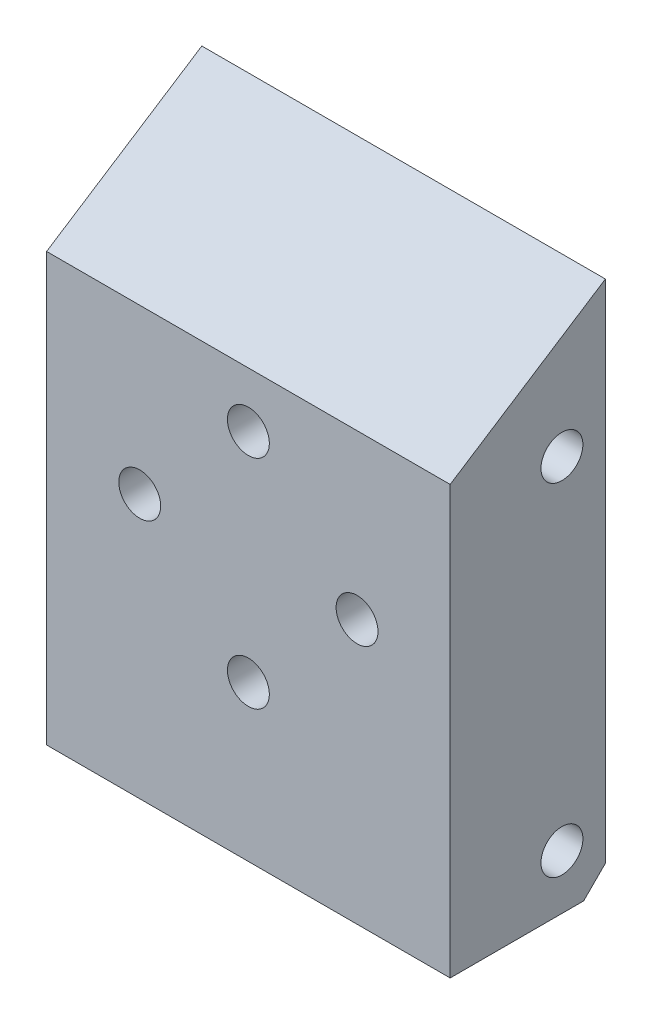
from build123d import *

# Parameters (mm, degrees)
ESBO_O1_W                  = 26
ESBO_O1_H                  = 34
RESSALTO_EXTRUS_O1_DEPTH   = 10
CHANFRO2_SIZE              = 1.4
CORTE_EXTRUS_O1_DEPTH      = 24.622023622
CORTE_EXTRUS_O1_DEPTH_BACK = 24.622023622
ESBO_O8_R                  = 1.35
CORTE_EXTRUS_O2_DEPTH      = 10
ESBO_O9_R                  = 1.025
CORTE_EXTRUS_O3_DEPTH      = 10
ESBO_O11_R                 = 1.35
CORTE_EXTRUS_O5_DEPTH      = 4


with BuildPart() as part:
    # Esboço1 → Ressalto-extrusão1 (new body)
    with BuildSketch(Plane.XY):
        Rectangle(ESBO_O1_W, ESBO_O1_H)
    extrude(amount=RESSALTO_EXTRUS_O1_DEPTH)

    # Chanfro2
    chanfro2_edges = [part.edges().sort_by_distance(p)[0] for p in [
        (0, -17, 0),
    ]]
    chamfer(chanfro2_edges, length=CHANFRO2_SIZE)

    # Esboço5 → Corte-extrusão1 (cut, two sides: drawn at the far end of the back side and taken through both)
    with BuildSketch(Plane(origin=(0, 0, 0), x_dir=(0, 0, -1), z_dir=(1, 0, 0)).offset(-CORTE_EXTRUS_O1_DEPTH_BACK)):
        Polygon((0, 17), (-10, 17), (-10, 10.5380702), align=None)
    extrude(amount=CORTE_EXTRUS_O1_DEPTH + CORTE_EXTRUS_O1_DEPTH_BACK, mode=Mode.SUBTRACT)

    # Esboço8 → Corte-extrusão2 (cut)
    with BuildSketch(Plane(origin=(13, 0, 0), x_dir=(0, 0, -1), z_dir=(1, 0, 0))):
        with Locations((-2.8, 8.5)):
            Circle(ESBO_O8_R)
        with Locations((-2.8, -13.5)):
            Circle(ESBO_O8_R)
    extrude(amount=-CORTE_EXTRUS_O2_DEPTH, mode=Mode.SUBTRACT)

    # Esboço9 → Corte-extrusão3 (cut)
    with BuildSketch(Plane.ZY.offset(13)):
        with Locations((2.8, 8.5)):
            Circle(ESBO_O9_R)
        with Locations((2.8, -13.5)):
            Circle(ESBO_O9_R)
    extrude(amount=-CORTE_EXTRUS_O3_DEPTH, mode=Mode.SUBTRACT)

    # Esboço11 → Corte-extrusão5 (cut)
    with BuildSketch(Plane.XY.offset(10)):
        with Locations((7, 0)):
            Circle(ESBO_O11_R)
        with Locations((0, -7)):
            Circle(ESBO_O11_R)
        with Locations((-7, 0)):
            Circle(ESBO_O11_R)
        with Locations((0, 7)):
            Circle(ESBO_O11_R)
    extrude(amount=-CORTE_EXTRUS_O5_DEPTH, mode=Mode.SUBTRACT)


solid = part.part
